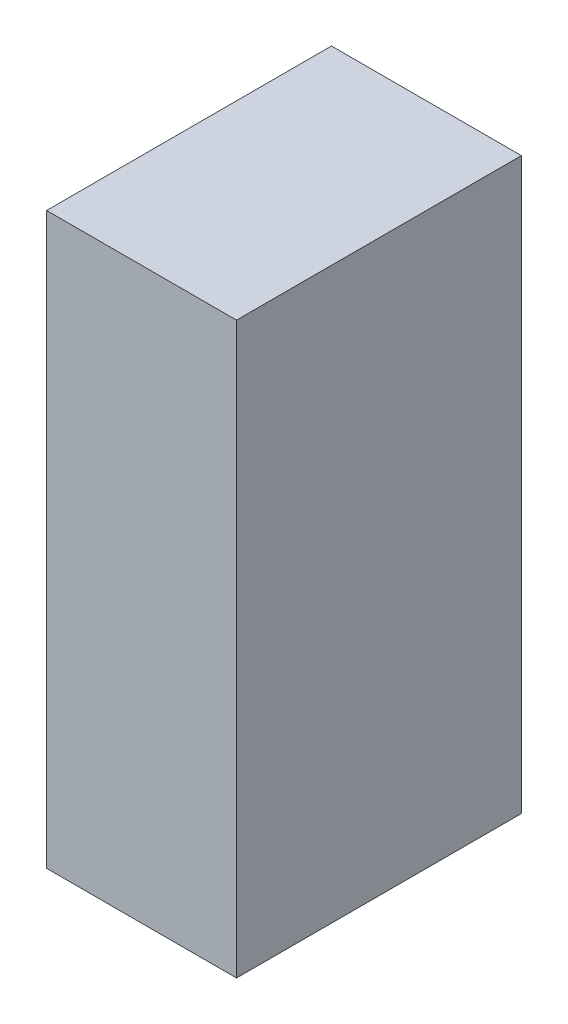
from build123d import *

# Parameters (mm, degrees)
SKETCH1_W           = 4
SKETCH1_H           = 6
BOSS_EXTRUDE1_DEPTH = 12


with BuildPart() as part:
    # Sketch1 → Boss-Extrude1 (new body)
    with BuildSketch(Plane(origin=(0, 0, 0), x_dir=(1, 0, 0), z_dir=(0, 1, 0))):
        Rectangle(SKETCH1_W, SKETCH1_H)
    extrude(amount=BOSS_EXTRUDE1_DEPTH)


solid = part.part
